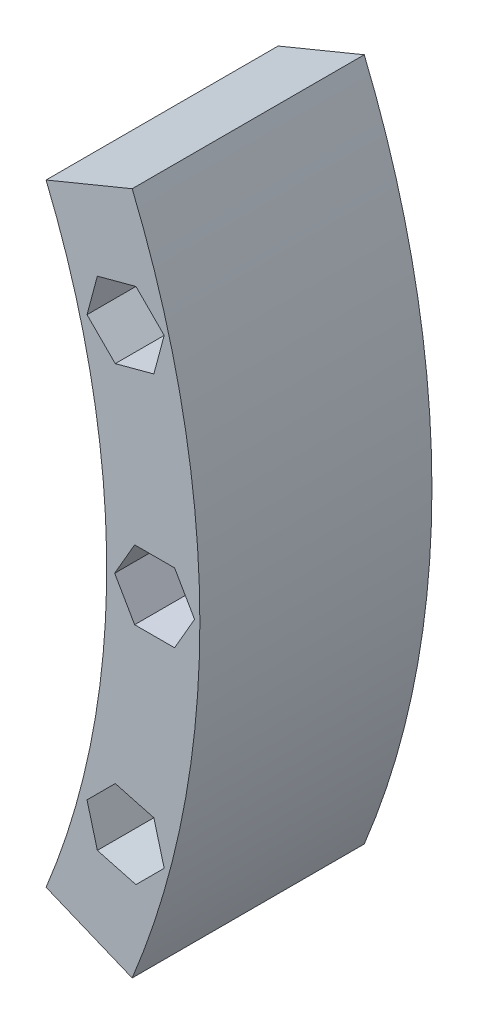
from build123d import *

# Parameters (mm, degrees)
BOSS_EXTRUDE1_START = 0.01
BOSS_EXTRUDE1_DEPTH = 21.8


with BuildPart() as part:
    # Sketch1 → Boss-Extrude1 (new body)
    with BuildSketch(Plane.XY.offset(BOSS_EXTRUDE1_START)):
        with BuildLine():
            Line((77.199593807, -31.819376425), (69.803225538, -28.770813414))
            ThreePointArc((69.803225538, -28.770813414), (75.5, 0), (69.803225538, 28.770813414))
            Line((69.803225538, 28.770813414), (77.199593807, 31.819376425))
            Line((77.199593807, 31.819376425), (77.893003332, 32.105179208))
            ThreePointArc((77.893003332, 32.105179208), (84.25, 0), (77.893003332, -32.105179208))
            Line((77.893003332, -32.105179208), (77.199593807, -31.819376425))
        make_face()
        Polygon((76.24722325, 0), (78.123611625, -3.25), (81.876388375, -3.25), (83.75277675, 0), (81.876388375, 3.25), (78.123611625, 3.25), align=None, mode=Mode.SUBTRACT)
        Polygon((79.927679991, 18.05190972), (76.302776008, 17.080619625), (73.64916212, 19.734233513), (74.620452215, 23.359137496), (78.245356198, 24.330427591), (80.898970086, 21.676813703), align=None, mode=Mode.SUBTRACT)
        Polygon((74.620452215, -23.359137496), (78.245356198, -24.330427591), (80.898970086, -21.676813703), (79.927679991, -18.05190972), (76.302776008, -17.080619625), (73.64916212, -19.734233513), align=None, mode=Mode.SUBTRACT)
    extrude(amount=BOSS_EXTRUDE1_DEPTH)


solid = part.part
